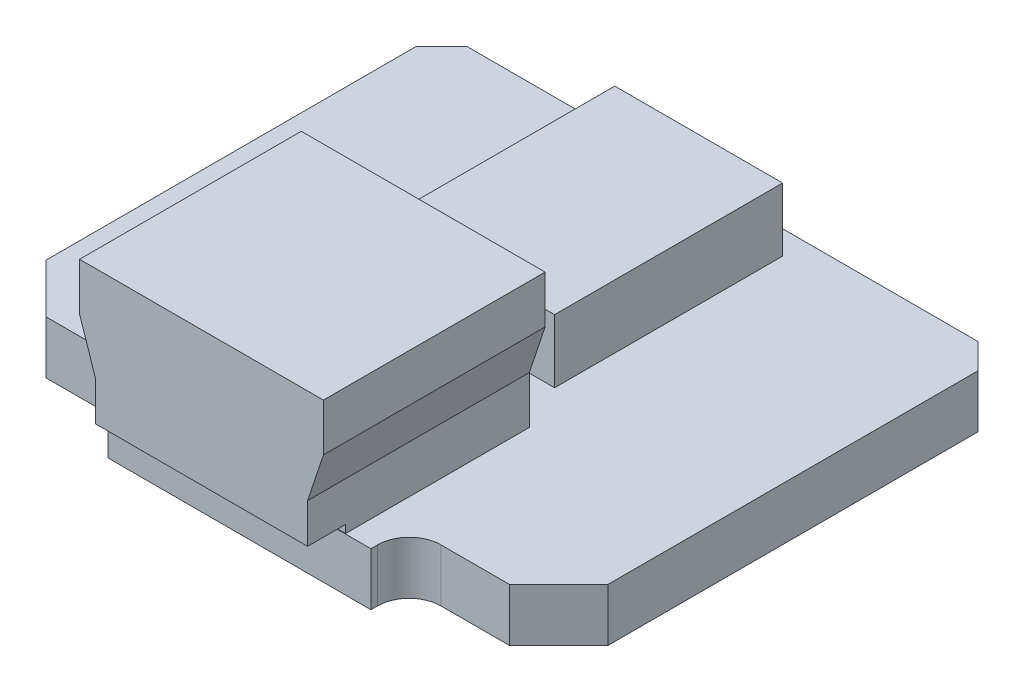
from build123d import *

# Parameters (mm, degrees)
PCB_DEPTH           = 1.67
SKETCH2_W           = 5.3
SKETCH2_H           = 7.2
PIC18_DEPTH         = 2
CRYSTAL_DEPTH       = 0.72
BOSS_EXTRUDE4_DEPTH = 2.5
USB_CONNECTOR_DEPTH = 7
SKETCH6_W           = 6.7
SKETCH6_H           = 0.25
CUT_EXTRUDE1_DEPTH  = 1.2


with BuildPart() as part:
    # PCB Sketch → PCB (new body)
    with BuildSketch(Plane(origin=(0, 0, 0), x_dir=(1, 0, 0), z_dir=(0, 1, 0))):
        with BuildLine():
            Line((-8.07, 7.625), (8.07, 7.625))
            Line((8.07, 7.625), (8.87, 6.825))
            Line((8.87, 6.825), (8.87, -4.865))
            Line((8.87, -4.865), (7.32, -6.415))
            Line((7.32, -6.415), (5.15, -6.415))
            ThreePointArc((5.15, -6.415), (4.442893219, -6.707893219), (4.15, -7.415))
            Line((4.15, -7.415), (4.15, -7.625))
            Line((4.15, -7.625), (-4.15, -7.625))
            Line((-4.15, -7.625), (-4.15, -7.415))
            ThreePointArc((-4.15, -7.415), (-4.442893219, -6.707893219), (-5.15, -6.415))
            Line((-5.15, -6.415), (-7.32, -6.415))
            Line((-7.32, -6.415), (-8.87, -4.865))
            Line((-8.87, -4.865), (-8.87, 6.825))
            Line((-8.87, 6.825), (-8.07, 7.625))
        make_face()
    extrude(amount=PCB_DEPTH)

    # Sketch2 → PIC18 (add)
    with BuildSketch(Plane(origin=(0, 1.67, 0), x_dir=(1, 0, 0), z_dir=(0, 1, 0))):
        with Locations((0, 3.275)):
            Rectangle(SKETCH2_W, SKETCH2_H)
    extrude(amount=PIC18_DEPTH)

    # Sketch3 → Crystal (add)
    with BuildSketch(Plane.XZ):
        with BuildLine():
            Line((-3.81, 1.585), (-3.81, -4.795))
            ThreePointArc((-3.81, -4.795), (-6.04, -7.025), (-8.27, -4.795))
            Line((-8.27, -4.795), (-8.27, 1.585))
            ThreePointArc((-8.27, 1.585), (-6.04, 3.815), (-3.81, 1.585))
        make_face()
    extrude(amount=CRYSTAL_DEPTH)

    # Sketch5 → Boss-Extrude4 (add)
    with BuildSketch(Plane.XZ.offset(0.72)):
        with BuildLine():
            Line((-4.255, 1.585), (-4.255, -4.715))
            ThreePointArc((-4.255, -4.715), (-6.04, -6.5), (-7.825, -4.715))
            Line((-7.825, -4.715), (-7.825, 1.585))
            ThreePointArc((-7.825, 1.585), (-6.04, 3.37), (-4.255, 1.585))
        make_face()
    extrude(amount=BOSS_EXTRUDE4_DEPTH)


with BuildPart() as body_2:
    # 3DSketch1 → USB Connector (new body)
    with BuildSketch(Plane(origin=(-3.849621322, 6.184444439, 1.825), x_dir=(0.847998304005088, -0.52999894000318, 0), z_dir=(0, 0, 1))):
        Polygon((0, 0), (6.529586941, 4.080991838), (7.324585351, 2.808994382), (7.695584609, 1.271997456), (8.490583019, 0), (2.808994382, -3.550992898), (2.013995972, -2.278995442), (0.79499841, -1.271997456), align=None)
    extrude(amount=USB_CONNECTOR_DEPTH)

    # Sketch6 → Cut-Extrude1 (cut)
    with BuildSketch(Plane.XY.offset(8.825)):
        with Locations((0.000378678, 1.809444439)):
            Rectangle(SKETCH6_W, SKETCH6_H)
    extrude(amount=-CUT_EXTRUDE1_DEPTH, mode=Mode.SUBTRACT)


solid = Compound([part.part, body_2.part])
